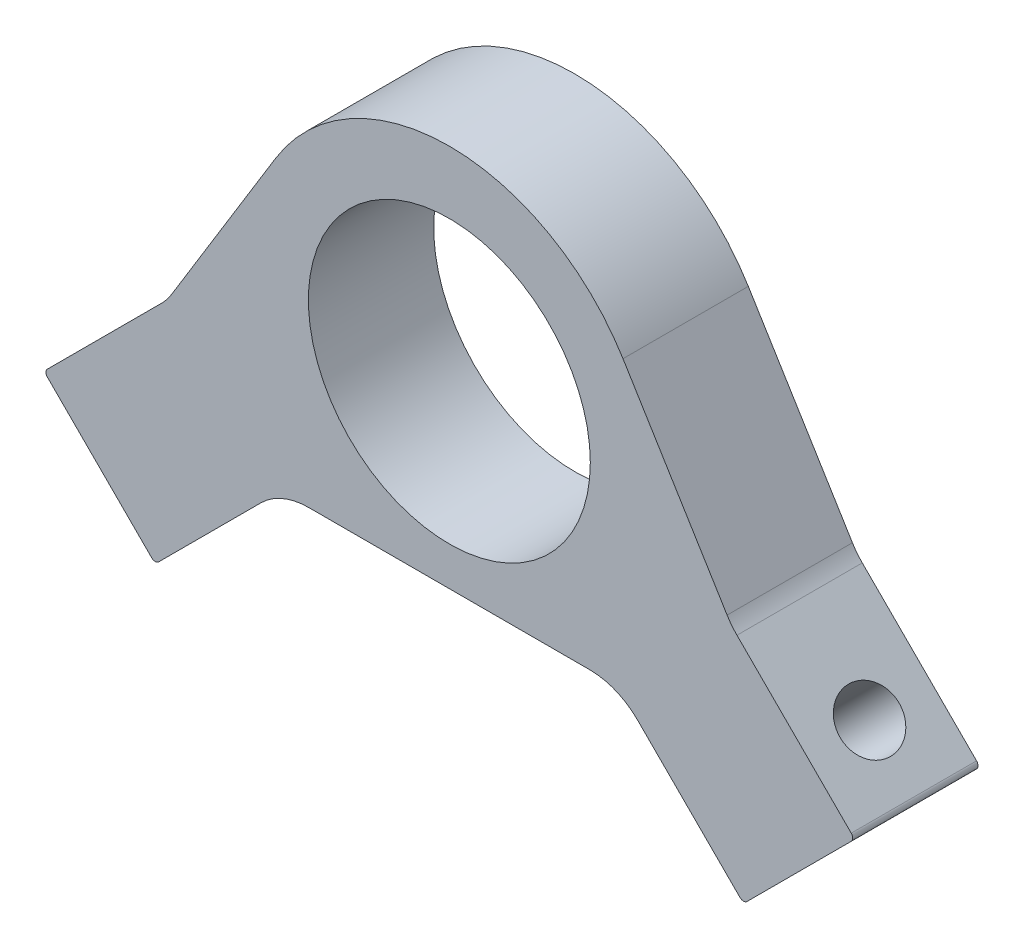
from build123d import *

# Parameters (mm, degrees)
BOSS_EXTRUDE1_DEPTH             = 6.35
SKETCH2_R                       = 14.2875
CUT_EXTRUDE1_DEPTH              = 141.169556232
F_6_0MM_CLEARANCE_DOWEL_HOLE1_D = 6
CUT_EXTRUDE2_DEPTH              = 77.016140262
CUT_EXTRUDE3_DEPTH              = 55.213982826
FILLET1_R                       = 6.858
FILLET2_R                       = 0.508


with BuildPart() as part:
    # Sketch1 → Boss-Extrude1 (new, symmetric)
    with BuildSketch(Plane.XY):
        Polygon((-48.967108015, -44.583045972), (-17.084062043, -12.7), (17.084062043, -12.7), (48.967108015, -44.583045972), (60.245461175, -33.304692812), (28.575, -1.634231637), (28.575, 33.007903412), (-28.575, 33.007903412), (-28.575, -1.634231637), (-60.245461175, -33.304692812), align=None)
    extrude(amount=BOSS_EXTRUDE1_DEPTH, both=True)

    # Sketch2 → Cut-Extrude1 (cut, through all)
    with BuildSketch(Plane(origin=(0, -92.915481637, 6.35), x_dir=(1, 0, 0), z_dir=(0, 0, 1))):
        with Locations((0, 98.425)):
            Circle(SKETCH2_R)
    extrude(amount=-CUT_EXTRUDE1_DEPTH, mode=Mode.SUBTRACT)

    # Ø6.0mm Clearance Dowel Hole1 (through all)
    with Locations(Plane(origin=(-59.928125, -32.987356637, 33.65), x_dir=(0, 0, 1), z_dir=(-0.7071067811865488, 0.7071067811865464, 0))):
        with Locations((-33.65, 33.499886537)):
            f_6_0mm_clearance_dowel_hole1 = Hole(F_6_0MM_CLEARANCE_DOWEL_HOLE1_D / 2)

    # Sketch5 → Cut-Extrude2 (cut, through all)
    with BuildSketch(Plane.XY.offset(6.35)):
        Polygon((-41.089466366, -14.148698003), (-29.811113206, -25.427051163), (29.811113206, -25.427051163), (41.089466366, -14.148698003), (91.882290576, -14.148698003), (91.882290576, -80.233341252), (-80.675634817, -80.233341252), (-80.675634817, -14.148698003), align=None)
    extrude(amount=-CUT_EXTRUDE2_DEPTH, mode=Mode.SUBTRACT)

    # Mirror1: Ø6.0mm Clearance Dowel Hole1 across plane
    add(f_6_0mm_clearance_dowel_hole1.mirror(Plane(origin=(0, 0, 0), x_dir=(0, 0, 1), z_dir=(1, 0, 0))), mode=Mode.SUBTRACT)

    # Sketch6 → Cut-Extrude3 (cut, through all)
    with BuildSketch(Plane.XY.offset(6.35)):
        with BuildLine():
            Line((-28.575, -1.634231637), (-17.599390848, 16.28763731))
            ThreePointArc((-17.599390848, 16.28763731), (0, 26.147018363), (17.599390848, 16.28763731))
            Line((17.599390848, 16.28763731), (28.575, -1.634231637))
            Line((28.575, -1.634231637), (28.575, 33.007903412))
            Line((28.575, 33.007903412), (-28.575, 33.007903412))
            Line((-28.575, 33.007903412), (-28.575, -1.634231637))
        make_face()
    extrude(amount=-CUT_EXTRUDE3_DEPTH, mode=Mode.SUBTRACT)

    # Fillet1
    fillet1_edges = [part.edges().sort_by_distance(p)[0] for p in [
        (-28.575, -1.634231637, 0),
        (28.575, -1.634231637, 0),
        (17.084062043, -12.7, 0),
        (-17.084062043, -12.7, 0),
    ]]
    fillet(fillet1_edges, radius=FILLET1_R)

    # Fillet2
    fillet2_edges = [part.edges().sort_by_distance(p)[0] for p in [
        (-41.089466366, -14.148698003, 0),
        (-29.811113206, -25.427051163, 0),
        (29.811113206, -25.427051163, 0),
        (41.089466366, -14.148698003, 0),
    ]]
    fillet(fillet2_edges, radius=FILLET2_R)


solid = part.part
